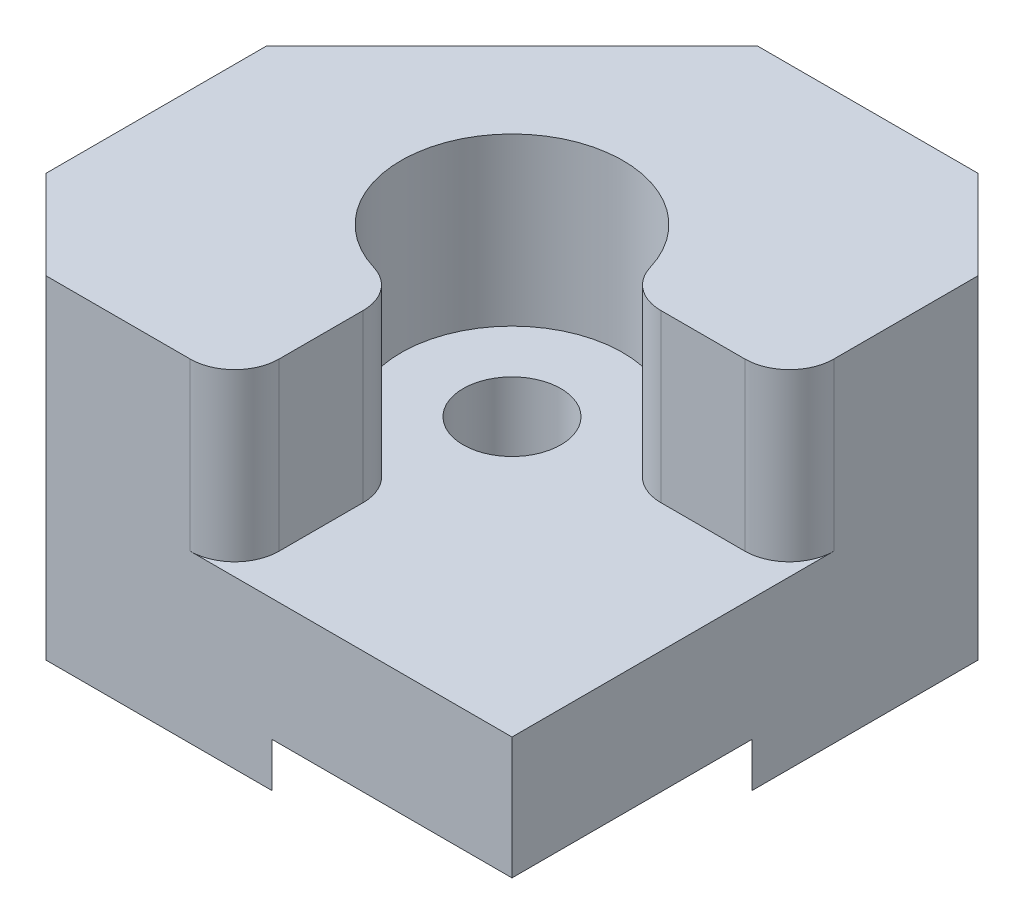
from build123d import *

# Parameters (mm, degrees)
SKETCH_1_W          = 25
SKETCH_1_H          = 25
EXTRUDE_1_DEPTH     = 7.5
CUT_EXTRUDE_START   = -7.5
CUT_EXTRUDE_3_DEPTH = 7.5
SKETCH_4_R          = 2.2
CUT_EXTRUDE_4_DEPTH = 20.20286437
CUT_EXTRUDE_5_DEPTH = 2
CHAMFER_1_SIZE      = 4
CHAMFER_2_SIZE      = 5
FILLET_3_R          = 2


with BuildPart() as part:
    # ｽｹｯﾁ1 → ﾎﾞｽ - 押し出し1 (new, symmetric)
    with BuildSketch(Plane(origin=(0, 0, 0), x_dir=(1, 0, 0), z_dir=(0, 1, 0))):
        Rectangle(SKETCH_1_W, SKETCH_1_H)
    extrude(amount=EXTRUDE_1_DEPTH, both=True)

    # ｽｹｯﾁ2 → ｶｯﾄ - 押し出し3 (cut)
    with BuildSketch(Plane(origin=(0, 7.5, 0), x_dir=(1, 0, 0), z_dir=(0, 1, 0)).offset(CUT_EXTRUDE_START)):
        with BuildLine():
            Line((12.5, 0), (5, 0))
            ThreePointArc((5, 0), (-3.535533906, 3.535533906), (0, -5))
            Line((0, -5), (0, -12.5))
            Line((0, -12.5), (12.5, -12.5))
            Line((12.5, -12.5), (12.5, 0))
        make_face()
    extrude(amount=CUT_EXTRUDE_3_DEPTH, mode=Mode.SUBTRACT)

    # ｽｹｯﾁ4 → ｶｯﾄ - 押し出し4 (cut, through all)
    with BuildSketch(Plane(origin=(0, 0, 0), x_dir=(1, 0, 0), z_dir=(0, 1, 0))):
        with Locations(Location((0, 0, 0), (0, 0, 270))):
            Circle(SKETCH_4_R)
    extrude(amount=-CUT_EXTRUDE_4_DEPTH, mode=Mode.SUBTRACT)

    # ｽｹｯﾁ5 → ｶｯﾄ - 押し出し5 (cut)
    with BuildSketch(Plane.XZ.offset(7.5)):
        Polygon((-12.5, -1.681266248), (1.681266248, 12.5), (12.5, 12.5), (12.5, 1.681266248), (-1.681266248, -12.5), (-12.5, -12.5), align=None)
    extrude(amount=-CUT_EXTRUDE_5_DEPTH, mode=Mode.SUBTRACT)

    # 面取り1
    chamfer_1_edges = [part.edges().sort_by_distance(p)[0] for p in [
        (-12.5, 0, 12.5),
        (-12.5, 1, -12.5),
        (12.5, 0, -12.5),
    ]]
    chamfer(chamfer_1_edges, length=CHAMFER_1_SIZE)

    # 面取り2
    chamfer_2_edges = [part.edges().sort_by_distance(p)[0] for p in [
        (-10.5, 7.5, -10.5),
    ]]
    chamfer(chamfer_2_edges, length=CHAMFER_2_SIZE)

    # ﾌｨﾚｯﾄ3
    fillet_3_edges = [part.edges().sort_by_distance(p)[0] for p in [
        (12.5, 3.75, 0),
        (0, 3.75, 12.5),
        (0, 3.75, 5),
        (5, 3.75, 0),
    ]]
    fillet(fillet_3_edges, radius=FILLET_3_R)


solid = part.part
